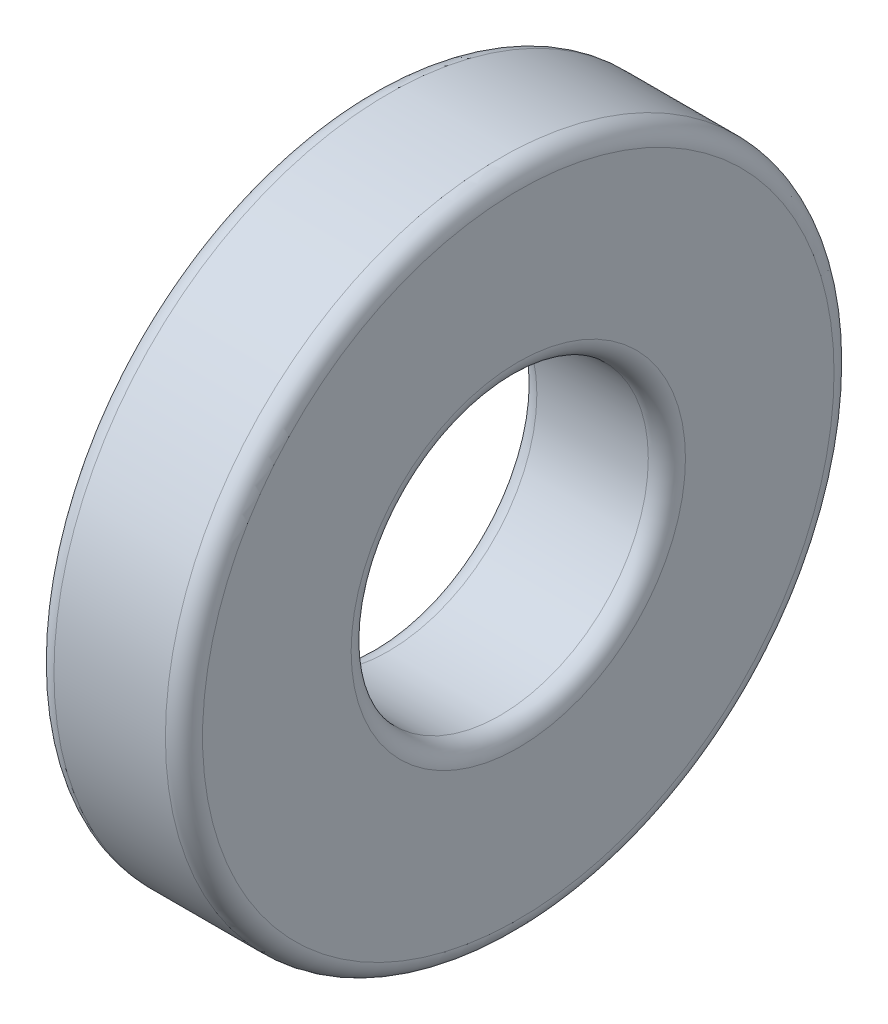
from build123d import *

# Parameters (mm, degrees)
SKETCH1_W = 6.35
SKETCH1_H = 7.9375
FILLET1_R = 0.79375


with BuildPart() as part:
    # Sketch1 → Revolve1 (revolve)
    with BuildSketch(Plane.XY, mode=Mode.PRIVATE) as revolve1_sk:
        with Locations((0, 10.31875)):
            Rectangle(SKETCH1_W, SKETCH1_H)
    revolve(revolve1_sk.sketch.rotate(Axis((0, 0, 0), (-1, 0, 0)), 90), axis=Axis((0, 0, 0), (-1, 0, 0)))

    # Fillet1
    fillet1_edges = [part.edges().sort_by_distance(p)[0] for p in [
        (-3.175, 0, 14.2875),
        (3.175, 0, 14.2875),
        (3.175, 0, 6.35),
        (-3.175, 0, 6.35),
    ]]
    fillet(fillet1_edges, radius=FILLET1_R)


solid = part.part
